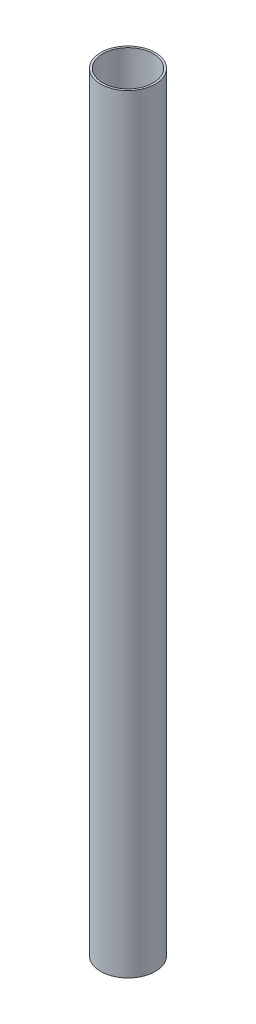
from build123d import *

# Parameters (mm, degrees)
ESBO_O1_R                = 27
ESBO_O1_R_2              = 25
RESSALTO_EXTRUS_O1_DEPTH = 760


with BuildPart() as part:
    # Esboço1 → Ressalto-extrusão1 (new body)
    with BuildSketch(Plane(origin=(0, 0, 0), x_dir=(1, 0, 0), z_dir=(0, 1, 0))):
        with Locations(Location((0, 0, 0), (0, 0, 270))):
            Circle(ESBO_O1_R)
        with Locations(Location((0, 0, 0), (0, 0, 270))):
            Circle(ESBO_O1_R_2, mode=Mode.SUBTRACT)
    extrude(amount=RESSALTO_EXTRUS_O1_DEPTH)


solid = part.part
